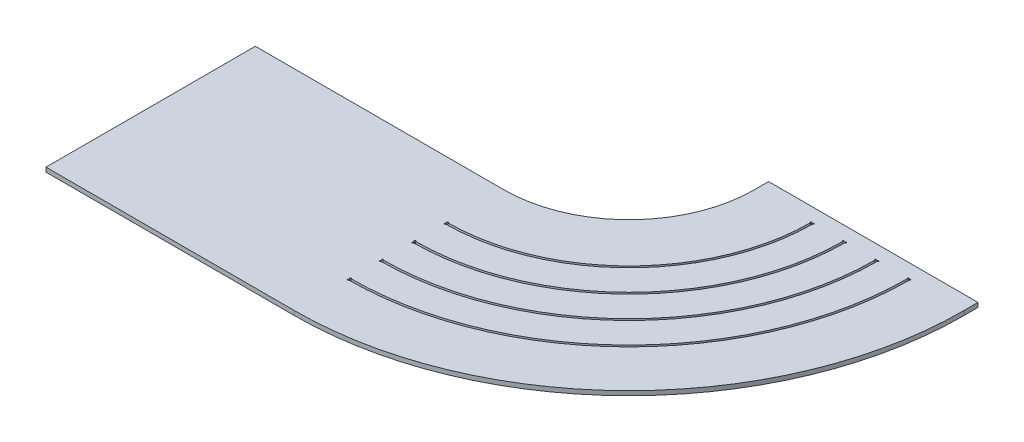
from build123d import *

# Parameters (mm, degrees)
BOSS_EXTRUDE1_DEPTH = 9.525


with BuildPart() as part:
    # Sketch1 → Boss-Extrude1 (new body)
    with BuildSketch(Plane.XZ.offset(-384.4690372)):
        with BuildLine():
            Line((1658.231590128, -268.886195663), (2113.481590128, -268.886195663))
            Line((2113.481590128, -268.886195663), (2113.481590128, -237.936195663))
            ThreePointArc((2113.481590128, -237.936195663), (1900.365161789, 276.572375998), (1385.856590128, 489.688804337))
            Line((1385.856590128, 489.688804337), (845.381590128, 489.688804337))
            Line((845.381590128, 489.688804337), (845.381590128, 34.438804337))
            Line((845.381590128, 34.438804337), (1385.856590128, 34.438804337))
            ThreePointArc((1385.856590128, 34.438804337), (1578.454799653, -45.337986138), (1658.231590128, -237.936195663))
            Line((1658.231590128, -237.936195663), (1658.231590128, -268.886195663))
        make_face()
        with BuildLine():
            Line((1782.731590128, -237.936195663), (1784.731590128, -237.936195663))
            ThreePointArc((1784.731590128, -237.936195663), (1787.293243272, -238.995861932), (1786.228780262, -236.436198295))
            ThreePointArc((1786.228780262, -236.436198295), (1668.964467645, 45.171681854), (1387.356587496, 162.435994471))
            ThreePointArc((1387.356587496, 162.435994471), (1384.796923859, 163.500457481), (1385.856590128, 160.938804337))
            Line((1385.856590128, 160.938804337), (1385.856590128, 158.938804337))
            ThreePointArc((1385.856590128, 158.938804337), (1384.794924432, 156.379150643), (1387.356587429, 157.435958937))
            ThreePointArc((1387.356587429, 157.435958937), (1665.428933739, 41.636147948), (1781.228744728, -236.436198362))
            ThreePointArc((1781.228744728, -236.436198362), (1780.171936434, -238.997861359), (1782.731590128, -237.936195663))
        make_face(mode=Mode.SUBTRACT)
        with BuildLine():
            Line((1993.481590128, -237.936195663), (1995.481590128, -237.936195663))
            ThreePointArc((1995.481590128, -237.936195663), (1998.042900945, -238.99620479), (1996.979749261, -236.436196793))
            ThreePointArc((1996.979749261, -236.436196793), (1817.98722178, 194.194435989), (1387.356588998, 373.186963469))
            ThreePointArc((1387.356588998, 373.186963469), (1384.796581001, 374.250115154), (1385.856590128, 371.688804337))
            Line((1385.856590128, 371.688804337), (1385.856590128, 369.688804337))
            ThreePointArc((1385.856590128, 369.688804337), (1384.795273945, 367.128800582), (1387.356588979, 368.186948284))
            ThreePointArc((1387.356588979, 368.186948284), (1814.451687874, 190.658902083), (1991.979734075, -236.436196812))
            ThreePointArc((1991.979734075, -236.436196812), (1990.921586373, -238.997511846), (1993.481590128, -237.936195663))
        make_face(mode=Mode.SUBTRACT)
        with BuildLine():
            Line((1923.231590128, -237.936195663), (1925.231590128, -237.936195663))
            ThreePointArc((1925.231590128, -237.936195663), (1927.792985423, -238.996120202), (1926.729510165, -236.436197105))
            ThreePointArc((1926.729510165, -236.436197105), (1768.312970402, 144.520184611), (1387.356588686, 302.936724374))
            ThreePointArc((1387.356588686, 302.936724374), (1384.796665589, 304.000199632), (1385.856590128, 301.438804337))
            Line((1385.856590128, 301.438804337), (1385.856590128, 299.438804337))
            ThreePointArc((1385.856590128, 299.438804337), (1384.795187976, 296.878886664), (1387.356588659, 297.936704967))
            ThreePointArc((1387.356588659, 297.936704967), (1764.777436496, 140.984650705), (1921.729490758, -236.436197132))
            ThreePointArc((1921.729490758, -236.436197132), (1920.671672455, -238.997597815), (1923.231590128, -237.936195663))
        make_face(mode=Mode.SUBTRACT)
        with BuildLine():
            Line((1852.981590128, -237.936195663), (1854.981590128, -237.936195663))
            ThreePointArc((1854.981590128, -237.936195663), (1857.543095111, -238.996010351), (1856.47919969, -236.436197568))
            ThreePointArc((1856.47919969, -236.436197568), (1718.638719024, 94.845933233), (1387.356588223, 232.686413898))
            ThreePointArc((1387.356588223, 232.686413898), (1384.796775441, 233.75030932), (1385.856590128, 231.188804337))
            Line((1385.856590128, 231.188804337), (1385.856590128, 229.188804337))
            ThreePointArc((1385.856590128, 229.188804337), (1384.795076077, 226.628998732), (1387.356588182, 227.686388229))
            ThreePointArc((1387.356588182, 227.686388229), (1715.103185118, 91.310399327), (1851.47917402, -236.436197609))
            ThreePointArc((1851.47917402, -236.436197609), (1850.421784523, -238.997709714), (1852.981590128, -237.936195663))
        make_face(mode=Mode.SUBTRACT)
    extrude(amount=BOSS_EXTRUDE1_DEPTH)


solid = part.part
